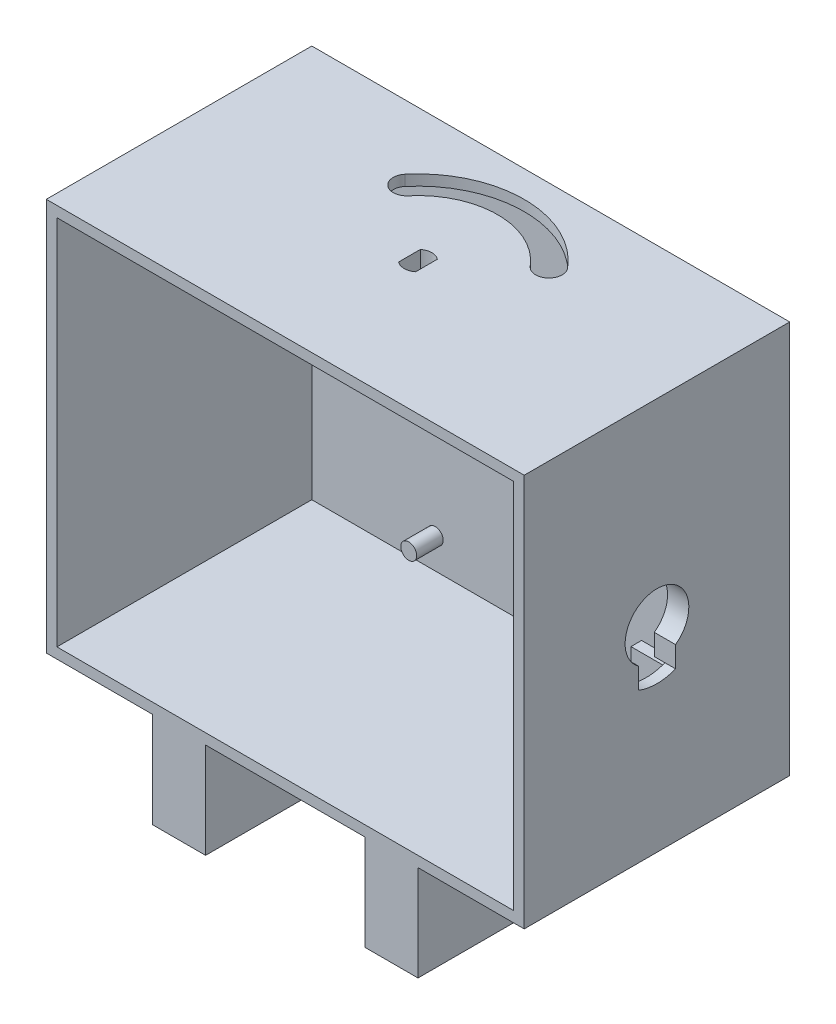
from build123d import *

# Parameters (mm, degrees)
SKETCH1_W           = 90
SKETCH1_H           = 74
SKETCH1_W_2         = 86
SKETCH1_H_2         = 70
BOSS_EXTRUDE1_DEPTH = 25
BOSS_EXTRUDE2_START = 25
SKETCH1_3_W         = 10
SKETCH1_3_H         = 18
BOSS_EXTRUDE2_DEPTH = 25
SKETCH2_W           = 86
SKETCH2_H           = 70
BOSS_EXTRUDE3_DEPTH = 2
SKETCH3_W           = 3.2
SKETCH3_H           = 4.098780306
CUT_EXTRUDE1_DEPTH  = 2
SKETCH3_4_R         = 4.1
SKETCH3_4_R_2       = 2.6
BOSS_EXTRUDE4_DEPTH = 7.5
SKETCH4_R           = 6
CUT_EXTRUDE2_DEPTH  = 2
BOSS_EXTRUDE5_START = -2
BOSS_EXTRUDE5_DEPTH = 2
BOSS_EXTRUDE6_START = -2
SKETCH4_4_W         = 16.2
SKETCH4_4_H         = 2
SKETCH4_4_W_2       = 2
SKETCH4_4_H_2       = 10
BOSS_EXTRUDE6_DEPTH = 9
SKETCH6_R           = 1.5
BOSS_EXTRUDE7_DEPTH = 5
SKETCH7_R           = 2.5
BOSS_EXTRUDE8_DEPTH = 3
CUT_EXTRUDE3_DEPTH  = 106.019045892


with BuildPart() as part:
    # Sketch1 → Boss-Extrude1 (new, symmetric)
    with BuildSketch(Plane.XY):
        Rectangle(SKETCH1_W, SKETCH1_H)
        Rectangle(SKETCH1_W_2, SKETCH1_H_2, mode=Mode.SUBTRACT)
    extrude(amount=BOSS_EXTRUDE1_DEPTH, both=True)

    # Sketch1<3> → Boss-Extrude2 (add)
    with BuildSketch(Plane.XY.offset(BOSS_EXTRUDE2_START)):
        with Locations((-20, -46)):
            Rectangle(SKETCH1_3_W, SKETCH1_3_H)
        with Locations((20, -46)):
            Rectangle(SKETCH1_3_W, SKETCH1_3_H)
    extrude(amount=-BOSS_EXTRUDE2_DEPTH)

    # Sketch2 → Boss-Extrude3 (add)
    with BuildSketch(Plane(origin=(0, 0, -25), x_dir=(-1, 0, 0), z_dir=(0, 0, -1))):
        Rectangle(SKETCH2_W, SKETCH2_H)
    extrude(amount=-BOSS_EXTRUDE3_DEPTH)

    # Sketch3 → Cut-Extrude1 (cut)
    with BuildSketch(Plane(origin=(0, 37, 0), x_dir=(1, 0, 0), z_dir=(0, 1, 0))):
        with BuildLine():
            Line((-1.6, 2.049390153), (1.6, 2.049390153))
            ThreePointArc((1.6, 2.049390153), (0, 2.6), (-1.6, 2.049390153))
        make_face()
        Rectangle(SKETCH3_W, SKETCH3_H)
        with BuildLine():
            ThreePointArc((-1.6, -2.049390153), (0, -2.6), (1.6, -2.049390153))
            Line((1.6, -2.049390153), (-1.6, -2.049390153))
        make_face()
    extrude(amount=-CUT_EXTRUDE1_DEPTH, mode=Mode.SUBTRACT)

    # Sketch3<4> → Boss-Extrude4 (add)
    # profile 1 of 3: a face of its own
    with BuildSketch(Plane(origin=(0, 37, 0), x_dir=(1, 0, 0), z_dir=(0, 1, 0))):
        with Locations(Location((0, 0, 0), (0, 0, 270))):
            Circle(SKETCH3_4_R)
        Circle(SKETCH3_4_R_2, mode=Mode.SUBTRACT)
    # profile 2 of 3: a face of its own
    with BuildSketch(Plane(origin=(0, 37, 0), x_dir=(1, 0, 0), z_dir=(0, 1, 0))):
        with BuildLine():
            Line((1.6, 2.049390153), (1.6, -2.049390153))
            ThreePointArc((1.6, -2.049390153), (2.336664289, -1.140175425), (2.6, 0))
            ThreePointArc((2.6, 0), (2.336664289, 1.140175425), (1.6, 2.049390153))
        make_face()
    # profile 3 of 3: a face of its own
    with BuildSketch(Plane(origin=(0, 37, 0), x_dir=(1, 0, 0), z_dir=(0, 1, 0))):
        with BuildLine():
            ThreePointArc((-1.6, 2.049390153), (-2.6, 0), (-1.6, -2.049390153))
            Line((-1.6, -2.049390153), (-1.6, 2.049390153))
        make_face()
    extrude(amount=-BOSS_EXTRUDE4_DEPTH)

    # Sketch4 → Cut-Extrude2 (cut)
    with BuildSketch(Plane(origin=(45, 0, 0), x_dir=(0, 0, -1), z_dir=(1, 0, 0))):
        Circle(SKETCH4_R)
        with BuildLine():
            Line((3.5, -8.831760866), (3.5, -4.873397172))
            ThreePointArc((3.5, -4.873397172), (0, -6), (-3.5, -4.873397172))
            Line((-3.5, -4.873397172), (-3.5, -8.831760866))
            ThreePointArc((-3.5, -8.831760866), (0, -9.5), (3.5, -8.831760866))
        make_face()
    extrude(amount=-CUT_EXTRUDE2_DEPTH, mode=Mode.SUBTRACT)

    # Sketch4<3> → Boss-Extrude5 (add)
    with BuildSketch(Plane(origin=(45, 0, 0), x_dir=(0, 0, -1), z_dir=(1, 0, 0)).offset(BOSS_EXTRUDE5_START)):
        with BuildLine():
            ThreePointArc((6, 0), (5.338539126, -2.738612788), (3.5, -4.873397172))
            Line((3.5, -4.873397172), (3.5, -8.831760866))
            ThreePointArc((3.5, -8.831760866), (7.858116823, -5.338539126), (9.5, 0))
            ThreePointArc((9.5, 0), (-5.338539126, 7.858116823), (-3.5, -8.831760866))
            Line((-3.5, -8.831760866), (-3.5, -4.873397172))
            ThreePointArc((-3.5, -4.873397172), (-2.738612788, 5.338539126), (6, 0))
        make_face()
    extrude(amount=-BOSS_EXTRUDE5_DEPTH)

    # Sketch4<4> → Boss-Extrude6 (add)
    with BuildSketch(Plane(origin=(45, 0, 0), x_dir=(0, 0, -1), z_dir=(1, 0, 0)).offset(BOSS_EXTRUDE6_START)):
        with Locations((0, 11.5)):
            Rectangle(SKETCH4_4_W, SKETCH4_4_H)
        with Locations((-7.1, -17)):
            Rectangle(SKETCH4_4_W_2, SKETCH4_4_H_2)
        with Locations((0, -23)):
            Rectangle(SKETCH4_4_W, SKETCH4_4_H)
        with Locations((7.1, -17)):
            Rectangle(SKETCH4_4_W_2, SKETCH4_4_H_2)
        with Locations((-7.1, 9.5)):
            Rectangle(SKETCH4_4_W_2, SKETCH4_4_H)
        with Locations((7.1, 9.5)):
            Rectangle(SKETCH4_4_W_2, SKETCH4_4_H)
    extrude(amount=-BOSS_EXTRUDE6_DEPTH)

    # Sketch6 → Boss-Extrude7 (add)
    with BuildSketch(Plane.XY.offset(-23)):
        with Locations((32.25, 3.5)):
            Circle(SKETCH6_R)
        with Locations((-18.75, 19.25)):
            Circle(SKETCH6_R)
        with Locations((-19.75, -29.25)):
            Circle(SKETCH6_R)
        with Locations((32.25, -24)):
            Circle(SKETCH6_R)
    extrude(amount=BOSS_EXTRUDE7_DEPTH)

    # Sketch7 → Boss-Extrude8 (add)
    with BuildSketch(Plane.ZY.offset(45)):
        Circle(SKETCH7_R)
    extrude(amount=BOSS_EXTRUDE8_DEPTH)

    # Sketch8 → Cut-Extrude3 (cut, through all)
    with BuildSketch(Plane.XZ.offset(-35)):
        with BuildLine():
            ThreePointArc((11.490666647, -9.641814145), (0, -15), (-11.490666647, -9.641814145))
            Line((-11.490666647, -9.641814145), (-15.320888862, -12.855752194))
            ThreePointArc((-15.320888862, -12.855752194), (0, -20), (15.320888862, -12.855752194))
            Line((15.320888862, -12.855752194), (11.490666647, -9.641814145))
        make_face()
        with BuildLine():
            Line((-15.320888862, -12.855752194), (-11.490666647, -9.641814145))
            ThreePointArc((-11.490666647, -9.641814145), (-15.012746779, -9.333672062), (-15.320888862, -12.855752194))
        make_face()
        with BuildLine():
            ThreePointArc((15.320888862, -12.855752194), (15.012746779, -9.333672062), (11.490666647, -9.641814145))
            Line((11.490666647, -9.641814145), (15.320888862, -12.855752194))
        make_face()
    extrude(amount=-CUT_EXTRUDE3_DEPTH, mode=Mode.SUBTRACT)


solid = part.part
